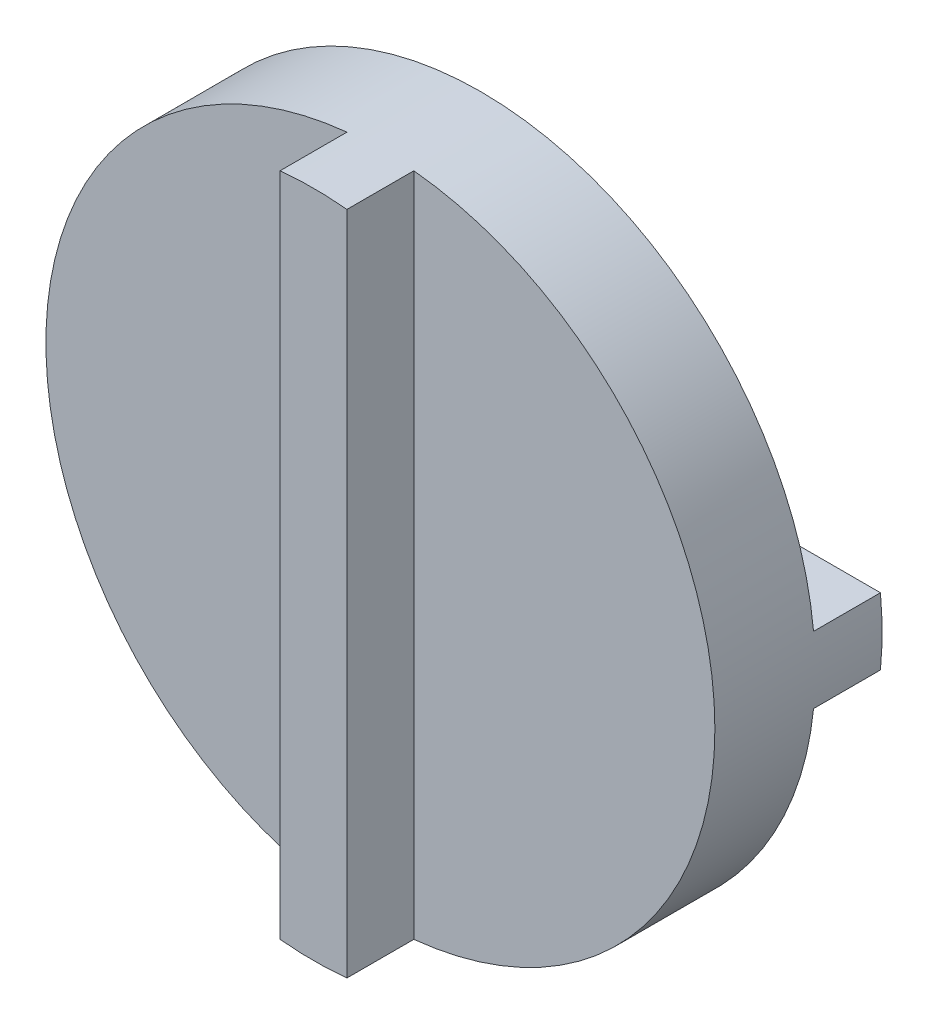
from build123d import *
from build123d.topology import SkipClean

# Parameters (mm, degrees)
SKETCH1_R           = 50
BOSS_EXTRUDE1_DEPTH = 15
BOSS_EXTRUDE2_DEPTH = 10
BOSS_EXTRUDE3_START = 10
BOSS_EXTRUDE3_DEPTH = 10


with BuildPart() as part:
    # Sketch1 → Boss-Extrude1 (new body)
    with BuildSketch(Plane.XY):
        Circle(SKETCH1_R)
    extrude(amount=BOSS_EXTRUDE1_DEPTH)

    # Sketch2 → Boss-Extrude2 (add)
    with BuildSketch(Plane.XY.offset(15)):
        with BuildLine():
            Line((-5, 49.749371855), (-5, -49.749371855))
            ThreePointArc((-5, -49.749371855), (0, -50), (5, -49.749371855))
            Line((5, -49.749371855), (5, 49.749371855))
            ThreePointArc((5, 49.749371855), (0, 50), (-5, 49.749371855))
        make_face()
    extrude(amount=BOSS_EXTRUDE2_DEPTH)

    # Sketch3 → Boss-Extrude3 (add)
    with SkipClean():  # the faces are left unmerged after this step: merging them gives an invalid solid
        with BuildSketch(Plane(origin=(0, 0, 0), x_dir=(-1, 0, 0), z_dir=(0, 0, -1)).offset(BOSS_EXTRUDE3_START)):
            with BuildLine():
                Line((-49.749371855, -5), (49.749371855, -5))
                ThreePointArc((49.749371855, -5), (50, 0), (49.749371855, 5))
                Line((49.749371855, 5), (-49.749371855, 5))
                ThreePointArc((-49.749371855, 5), (-50, 0), (-49.749371855, -5))
            make_face()
        extrude(amount=-BOSS_EXTRUDE3_DEPTH)


solid = part.part
